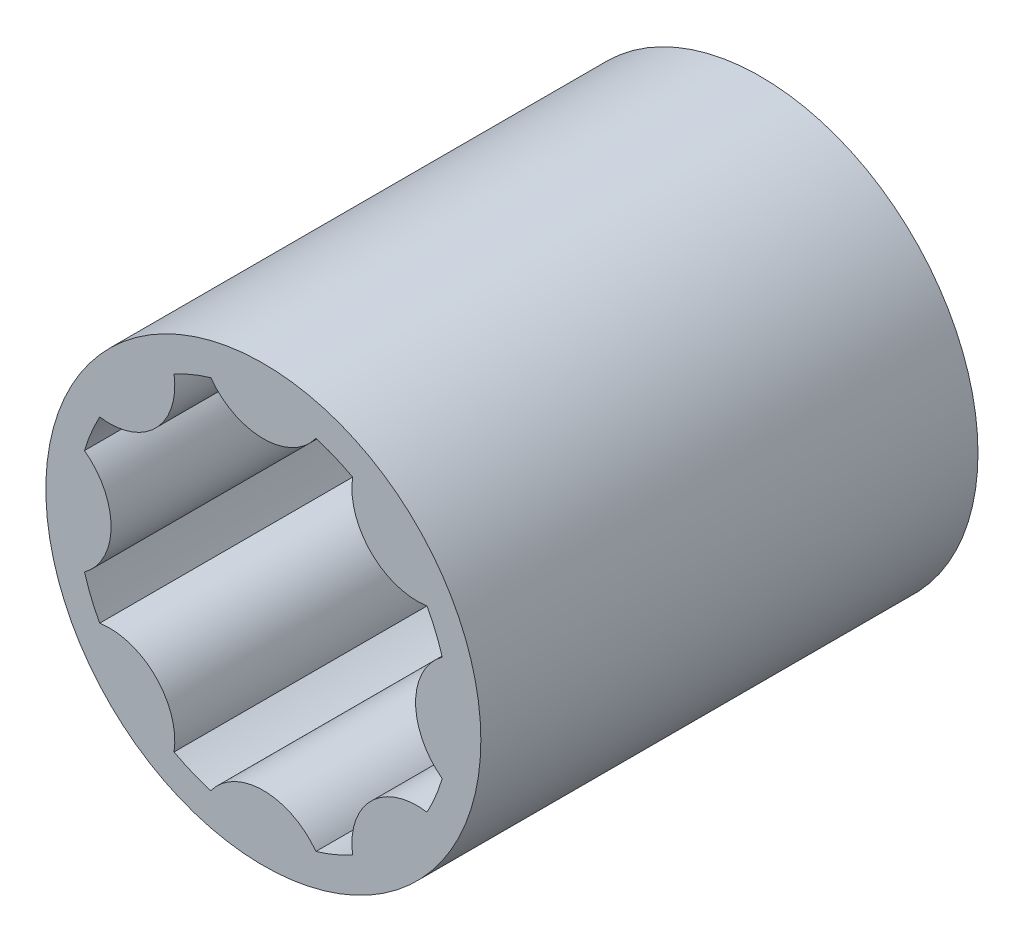
from build123d import *

# Parameters (mm, degrees)
SKETCH1_R           = 17.5
BOSS_EXTRUDE1_DEPTH = 40


with BuildPart() as part:
    # Sketch1 → Boss-Extrude1 (new body)
    with BuildSketch(Plane.XY):
        Circle(SKETCH1_R)
        with BuildLine():
            ThreePointArc((-13.167433825, 7.184614567), (-13.858192988, 5.740251485), (-14.391071429, 4.230492068))
            ThreePointArc((-14.391071429, 4.230492068), (-12.25, 0), (-14.391071429, -4.230492068))
            ThreePointArc((-14.391071429, -4.230492068), (-13.858192988, -5.740251485), (-13.167433825, -7.184614567))
            ThreePointArc((-13.167433825, -7.184614567), (-8.66205807, -8.66205807), (-7.184614567, -13.167433825))
            ThreePointArc((-7.184614567, -13.167433825), (-5.740251485, -13.858192988), (-4.230492068, -14.391071429))
            ThreePointArc((-4.230492068, -14.391071429), (0, -12.25), (4.230492068, -14.391071429))
            ThreePointArc((4.230492068, -14.391071429), (5.740251485, -13.858192988), (7.184614567, -13.167433825))
            ThreePointArc((7.184614567, -13.167433825), (8.66205807, -8.66205807), (13.167433825, -7.184614567))
            ThreePointArc((13.167433825, -7.184614567), (13.858192988, -5.740251485), (14.391071429, -4.230492068))
            ThreePointArc((14.391071429, -4.230492068), (12.25, 0), (14.391071429, 4.230492068))
            ThreePointArc((14.391071429, 4.230492068), (13.858192988, 5.740251485), (13.167433825, 7.184614567))
            ThreePointArc((13.167433825, 7.184614567), (8.66205807, 8.66205807), (7.184614567, 13.167433825))
            ThreePointArc((7.184614567, 13.167433825), (5.740251485, 13.858192988), (4.230492068, 14.391071429))
            ThreePointArc((4.230492068, 14.391071429), (0, 12.25), (-4.230492068, 14.391071429))
            ThreePointArc((-4.230492068, 14.391071429), (-5.740251485, 13.858192988), (-7.184614567, 13.167433825))
            ThreePointArc((-7.184614567, 13.167433825), (-8.66205807, 8.66205807), (-13.167433825, 7.184614567))
        make_face(mode=Mode.SUBTRACT)
    extrude(amount=BOSS_EXTRUDE1_DEPTH)


solid = part.part
